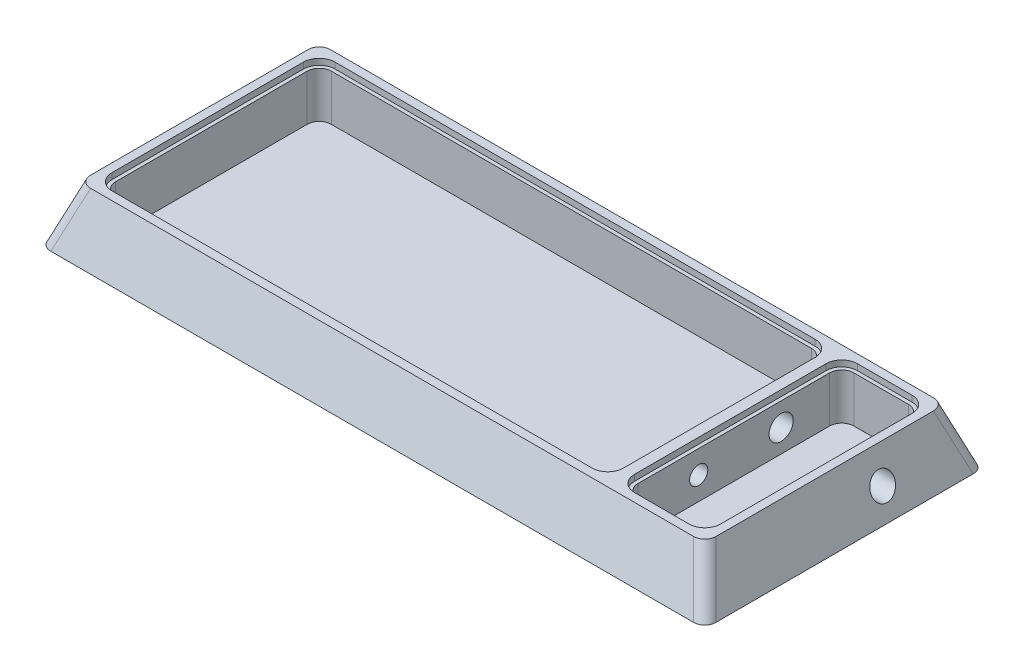
from build123d import *

# Parameters (mm, degrees)
SKETCH2_W                      = 516
SKETCH2_H                      = 198
SKETCH2_W_2                    = 65
SKETCH2_H_2                    = 178
SKETCH2_W_3                    = 416
BOSS_EXTRUDE2_DEPTH            = 45
DRAFT3_ANGLE                   = 20
FILLET1_R                      = 10
SKETCH2_3_W                    = 416
SKETCH2_3_H                    = 178
SKETCH2_3_W_2                  = 350
SKETCH2_3_H_2                  = 80
SKETCH2_3_W_3                  = 376
SKETCH2_3_H_3                  = 68
SKETCH2_3_W_4                  = 65
BOSS_EXTRUDE3_DEPTH            = 2
CUT_EXTRUDE1_DEPTH             = 5
CUT_EXTRUDE2_REACH             = 538.858
SKETCH4_R                      = 10
CUT_EXTRUDE2_DIRECTION_2_DEPTH = 54
SKETCH5_R                      = 7.5
CUT_EXTRUDE3_DEPTH             = 15


with BuildPart() as part:
    # Sketch2 → Boss-Extrude2 (new body)
    with BuildSketch(Plane(origin=(0, 0, 0), x_dir=(1, 0, 0), z_dir=(0, 1, 0))):
        Rectangle(SKETCH2_W, SKETCH2_H)
        with Locations((215.5, 0)):
            Rectangle(SKETCH2_W_2, SKETCH2_H_2, mode=Mode.SUBTRACT)
        with Locations((-40, 0)):
            Rectangle(SKETCH2_W_3, SKETCH2_H_2, mode=Mode.SUBTRACT)
    extrude(amount=BOSS_EXTRUDE2_DEPTH)

    # Draft3
    draft3_faces = [part.faces().sort_by_distance(p)[0] for p in [
        (0, 22.5, -99),
        (258, 22.5, 0),
        (0, 22.5, 99),
        (-258, 22.5, 0),
    ]]
    draft(draft3_faces, Plane.ZX.offset(45), DRAFT3_ANGLE)

    # Fillet1
    fillet1_edges = [part.edges().sort_by_distance(p)[0] for p in [
        (-248, 22.5, 89),
        (168, 22.5, 89),
        (168, 22.5, -89),
        (-248, 22.5, -89),
        (-266.189330271, 22.5, -107.189330271),
        (266.189330271, 22.5, -107.189330271),
        (266.189330271, 22.5, 107.189330271),
        (-266.189330271, 22.5, 107.189330271),
        (248, 22.5, 89),
        (248, 22.5, -89),
        (183, 22.5, -89),
        (183, 22.5, 89),
    ]]
    fillet(fillet1_edges, radius=FILLET1_R)

    # Sketch2<3> → Boss-Extrude3 (add)
    # profile 1 of 4: a face of its own
    with BuildSketch(Plane(origin=(0, 0, 0), x_dir=(1, 0, 0), z_dir=(0, 1, 0))):
        with Locations((-40, 0)):
            Rectangle(SKETCH2_3_W, SKETCH2_3_H)
        with Locations((-63, 44)):
            Rectangle(SKETCH2_3_W_2, SKETCH2_3_H_2, mode=Mode.SUBTRACT)
        with Locations((-50, -45)):
            Rectangle(SKETCH2_3_W_3, SKETCH2_3_H_3, mode=Mode.SUBTRACT)
    # profile 2 of 4: a face of its own
    with BuildSketch(Plane(origin=(0, 0, 0), x_dir=(1, 0, 0), z_dir=(0, 1, 0))):
        with Locations((-50, -45)):
            Rectangle(SKETCH2_3_W_3, SKETCH2_3_H_3)
    # profile 3 of 4: a face of its own
    with BuildSketch(Plane(origin=(0, 0, 0), x_dir=(1, 0, 0), z_dir=(0, 1, 0))):
        with Locations((-63, 44)):
            Rectangle(SKETCH2_3_W_2, SKETCH2_3_H_2)
    # profile 4 of 4: a face of its own
    with BuildSketch(Plane(origin=(0, 0, 0), x_dir=(1, 0, 0), z_dir=(0, 1, 0))):
        with Locations((215.5, 0)):
            Rectangle(SKETCH2_3_W_4, SKETCH2_3_H)
    extrude(amount=BOSS_EXTRUDE3_DEPTH)

    # Sketch3 → Cut-Extrude1 (cut)
    with BuildSketch(Plane(origin=(0, 45, 0), x_dir=(1, 0, 0), z_dir=(0, 1, 0))):
        with BuildLine():
            Line((171, -79), (171, 79))
            ThreePointArc((171, 79), (167.192388155, 88.192388155), (158, 92))
            Line((158, 92), (-238, 92))
            ThreePointArc((-238, 92), (-247.192388155, 88.192388155), (-251, 79))
            Line((-251, 79), (-251, -79))
            ThreePointArc((-251, -79), (-247.192388155, -88.192388155), (-238, -92))
            Line((-238, -92), (158, -92))
            ThreePointArc((158, -92), (167.192388155, -88.192388155), (171, -79))
        make_face()
        with BuildLine():
            Line((193, -92), (238, -92))
            ThreePointArc((238, -92), (247.192388155, -88.192388155), (251, -79))
            Line((251, -79), (251, 79))
            ThreePointArc((251, 79), (247.192388155, 88.192388155), (238, 92))
            Line((238, 92), (193, 92))
            ThreePointArc((193, 92), (183.807611845, 88.192388155), (180, 79))
            Line((180, 79), (180, -79))
            ThreePointArc((180, -79), (183.807611845, -88.192388155), (193, -92))
        make_face()
    extrude(amount=-CUT_EXTRUDE1_DEPTH, mode=Mode.SUBTRACT)

    # Cut-Extrude2: up to this face of the body (flat: up to its plane)
    cut_extrude2_end = Plane(part.part.faces().sort_by_distance((168, 21, 0))[0])
    # Sketch4 → Cut-Extrude2 (cut, up to the picked face)
    with BuildSketch(Plane.ZY.offset(-248), mode=Mode.PRIVATE) as cut_extrude2_sk1:
        with Locations((-39, 21)):
            Circle(SKETCH4_R)
    cut_extrude2_tool1 = split(extrude(cut_extrude2_sk1.sketch, amount=CUT_EXTRUDE2_REACH, mode=Mode.PRIVATE), bisect_by=cut_extrude2_end, keep=Keep.BOTH, mode=Mode.PRIVATE)
    add(cut_extrude2_tool1.solids().sort_by(Axis((248, 21, -39), (-1, 0, 0)))[0], mode=Mode.SUBTRACT)

    # Sketch4 → Cut-Extrude2 direction 2 (cut)
    with BuildSketch(Plane.ZY.offset(-248)):
        with Locations((-39, 21)):
            Circle(SKETCH4_R)
    extrude(amount=-CUT_EXTRUDE2_DIRECTION_2_DEPTH, mode=Mode.SUBTRACT)

    # Sketch5 → Cut-Extrude3 (cut)
    with BuildSketch(Plane(origin=(183, 0, 0), x_dir=(0, 0, -1), z_dir=(1, 0, 0))):
        with Locations((-29, 21)):
            Circle(SKETCH5_R)
    extrude(amount=-CUT_EXTRUDE3_DEPTH, mode=Mode.SUBTRACT)


solid = part.part
